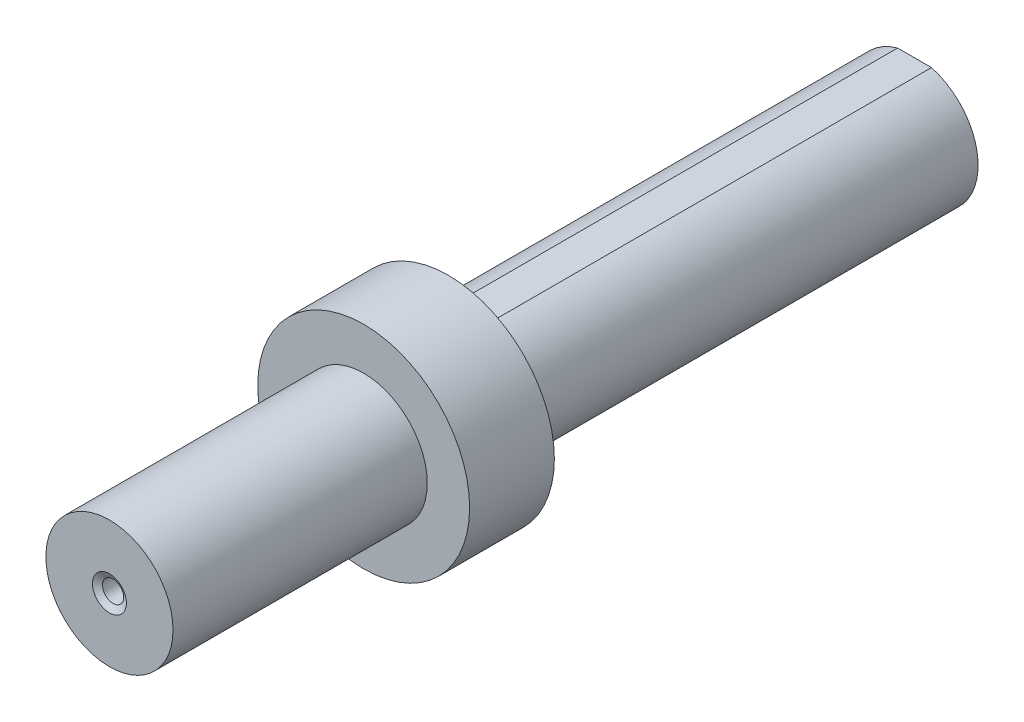
from build123d import *

# Parameters (mm, degrees)
SKETCH1_R                       = 12.5
F_25MM_DIA_DEPTH                = 10
F_15MM_START                    = -10
SKETCH2_R                       = 7.5
F_15MM_DIA_BEARING_END_DEPTH    = 40
F_15MM_START_2                  = 55
SKETCH3_R                       = 7.5
F_15MM_DIA_GEAR_END_DEPTH       = 55
M3X0_5_TAPPED_HOLE1_D           = 2.5
M3X0_5_TAPPED_HOLE1_DEPTH       = 15
M3X0_5_TAPPED_HOLE1_CSINK_D     = 4
M3X0_5_TAPPED_HOLE1_CSINK_ANGLE = 120
M3X0_5_TAPPED_HOLE1_TIP         = 0.751075774
SKETCH8_W                       = 4
SKETCH8_H                       = 3.025433208
CUT_EXTRUDE1_DEPTH              = 55


with BuildPart() as part:
    # Sketch1 → 25mm dia (new body)
    with BuildSketch(Plane.XY):
        Circle(SKETCH1_R)
    extrude(amount=F_25MM_DIA_DEPTH)

    # Sketch2 → 15mm dia bearing end (add)
    with BuildSketch(Plane.XY.offset(10).offset(F_15MM_START)):
        Circle(SKETCH2_R)
    extrude(amount=F_15MM_DIA_BEARING_END_DEPTH)

    # Sketch3 → 15mm dia gear end (add)
    with BuildSketch(Plane(origin=(0, 0, 0), x_dir=(-1, 0, 0), z_dir=(0, 0, -1)).offset(F_15MM_START_2)):
        with Locations(Location((0, 0, 0), (0, 0, 180))):
            Circle(SKETCH3_R)
    extrude(amount=-F_15MM_DIA_GEAR_END_DEPTH)

    # M3x0.5 Tapped Hole1
    with Locations(Plane.XY.offset(40)):
        with Locations((0, 0)):
            CounterSinkHole(M3X0_5_TAPPED_HOLE1_D / 2, M3X0_5_TAPPED_HOLE1_CSINK_D / 2, depth=M3X0_5_TAPPED_HOLE1_DEPTH, counter_sink_angle=M3X0_5_TAPPED_HOLE1_CSINK_ANGLE)
            with Locations((0, 0, -(M3X0_5_TAPPED_HOLE1_DEPTH + M3X0_5_TAPPED_HOLE1_TIP / 2))):  # 118° drill point
                Cone(0, M3X0_5_TAPPED_HOLE1_D / 2, M3X0_5_TAPPED_HOLE1_TIP, mode=Mode.SUBTRACT)

    # Sketch8 → Cut-Extrude1 (cut)
    with BuildSketch(Plane(origin=(0, 0, -55), x_dir=(-1, 0, 0), z_dir=(0, 0, -1))):
        with Locations((0, 8.741132751)):
            Rectangle(SKETCH8_W, SKETCH8_H)
    extrude(amount=-CUT_EXTRUDE1_DEPTH, mode=Mode.SUBTRACT)


solid = part.part
